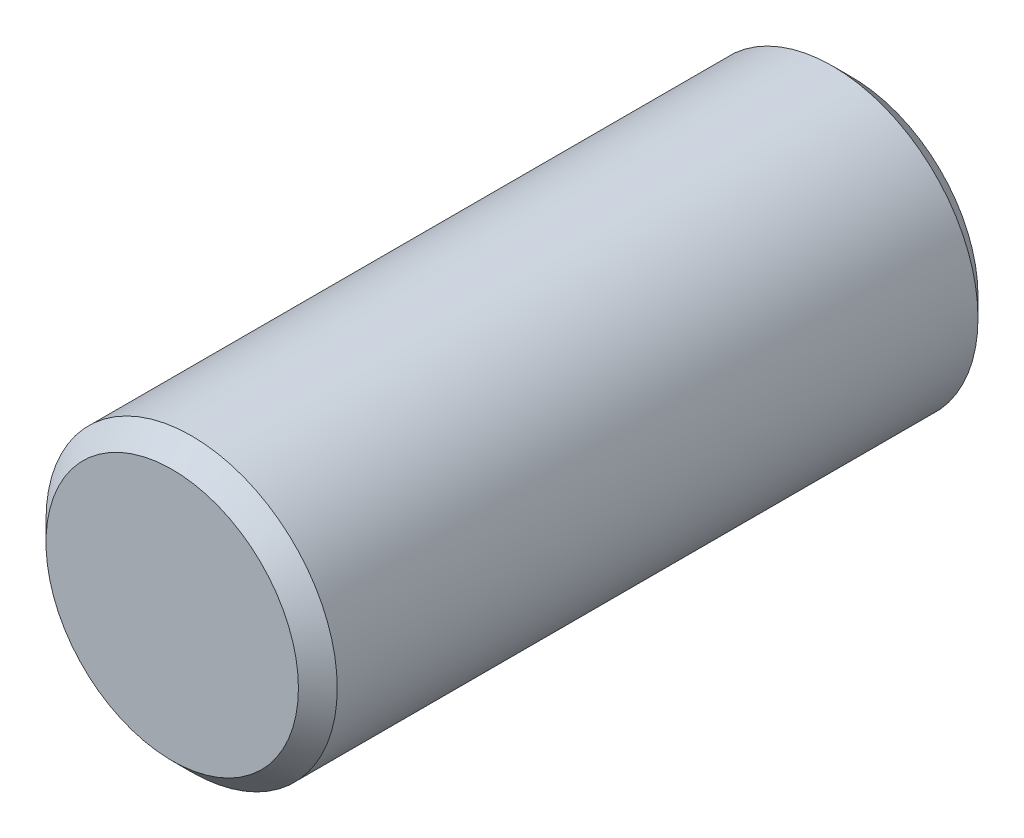
from build123d import *

# Parameters (mm, degrees)
SKETCH1_R           = 1.5
BOSS_EXTRUDE1_DEPTH = 3.5
CHAMFER1_SIZE       = 0.2


with BuildPart() as part:
    # Sketch1 → Boss-Extrude1 (new, symmetric)
    with BuildSketch(Plane.XY):
        Circle(SKETCH1_R)
    extrude(amount=BOSS_EXTRUDE1_DEPTH, both=True)

    # Chamfer1
    chamfer1_edges = [part.edges().sort_by_distance(p)[0] for p in [
        (-1.5, 0, -3.5),
        (-1.5, 0, 3.5),
    ]]
    chamfer(chamfer1_edges, length=CHAMFER1_SIZE)


solid = part.part
